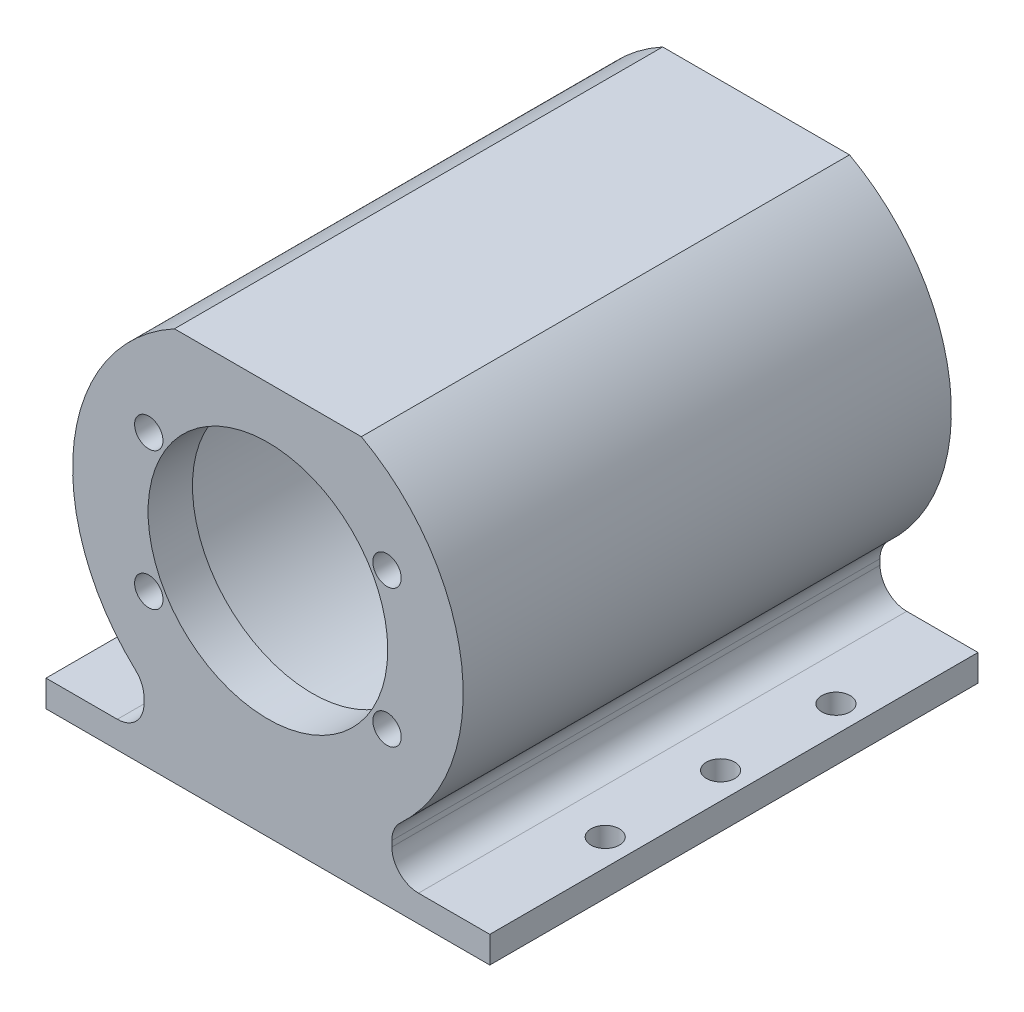
from build123d import *

# Parameters (mm, degrees)
IZIM1_R                     = 18.65
IZIM1_W                     = 50
IZIM1_H                     = 3
Y_KSEKLIK_EKSTR_ZYON4_DEPTH = 55
RADYUS1_R                   = 3
RADYUS2_R                   = 3
IZIM7_R                     = 1.6
KES_EKSTR_ZYON1_DEPTH       = 55
IZIM8_R                     = 1.6
KES_EKSTR_ZYON2_DEPTH       = 55
Y_KSEKLIK_EKSTR_ZYON5_START = -5
IZIM10_R                    = 18.65
IZIM10_R_2                  = 13.5
IZIM10_R_3                  = 1.6
Y_KSEKLIK_EKSTR_ZYON5_DEPTH = 5


with BuildPart() as part:
    # Çizim1 → Yükseklik-Ekstrüzyon4 (new body)
    # profile 1 of 4: a face of its own
    with BuildSketch(Plane.XY):
        with BuildLine():
            ThreePointArc((-10.528747961, 42.81697353), (-21.902220366, 25.57189359), (-13.964240044, 6.5))
            ThreePointArc((-13.964240044, 6.5), (-7.416198487, 2.787684823), (0, 1.5))
            ThreePointArc((0, 1.5), (7.416198487, 2.787684823), (13.964240044, 6.5))
            ThreePointArc((13.964240044, 6.5), (19.889862757, 14.098225725), (22, 23.5))
            ThreePointArc((22, 23.5), (18.916030968, 34.733155052), (10.528747961, 42.81697353))
            Line((10.528747961, 42.81697353), (-10.528747961, 42.81697353))
        make_face()
        with Locations((0, 23.5)):
            Circle(IZIM1_R, mode=Mode.SUBTRACT)
    # profile 2 of 4: a face of its own
    with BuildSketch(Plane.XY):
        Rectangle(IZIM1_W, IZIM1_H)
    # profile 3 of 4: a face of its own
    with BuildSketch(Plane.XY):
        with BuildLine():
            ThreePointArc((0, 1.5), (-7.416198487, 2.787684823), (-13.964240044, 6.5))
            Line((-13.964240044, 6.5), (-13.964240044, 1.5))
            Line((-13.964240044, 1.5), (0, 1.5))
        make_face()
    # profile 4 of 4: a face of its own
    with BuildSketch(Plane.XY):
        with BuildLine():
            ThreePointArc((13.964240044, 6.5), (7.416198487, 2.787684823), (0, 1.5))
            Line((0, 1.5), (13.964240044, 1.5))
            Line((13.964240044, 1.5), (13.964240044, 6.5))
        make_face()
    extrude(amount=Y_KSEKLIK_EKSTR_ZYON4_DEPTH)

    # Radyus1
    radyus1_edges = [part.edges().sort_by_distance(p)[0] for p in [
        (13.964240044, 6.5, 27.5),
        (13.964240044, 1.5, 27.5),
    ]]
    fillet(radyus1_edges, radius=RADYUS1_R)

    # Radyus2
    radyus2_edges = [part.edges().sort_by_distance(p)[0] for p in [
        (-13.964240044, 1.5, 27.5),
        (-13.964240044, 6.5, 27.5),
    ]]
    fillet(radyus2_edges, radius=RADYUS2_R)

    # Çizim7 → Kes-Ekstrüzyon1 (cut)
    with BuildSketch(Plane(origin=(0, 1.5, 0), x_dir=(1, 0, 0), z_dir=(0, 1, 0))):
        with Locations(Location((-22, -13, 0), (0, 0, 270))):
            Circle(IZIM7_R)
        with Locations(Location((-22, -26, 0), (0, 0, 270))):
            Circle(IZIM7_R)
        with Locations(Location((-22, -39, 0), (0, 0, 270))):
            Circle(IZIM7_R)
    extrude(amount=-KES_EKSTR_ZYON1_DEPTH, mode=Mode.SUBTRACT)

    # Çizim8 → Kes-Ekstrüzyon2 (cut)
    with BuildSketch(Plane(origin=(0, 1.5, 0), x_dir=(1, 0, 0), z_dir=(0, 1, 0))):
        with Locations(Location((22, -13, 0), (0, 0, 270))):
            Circle(IZIM8_R)
        with Locations(Location((22, -26, 0), (0, 0, 270))):
            Circle(IZIM8_R)
        with Locations(Location((22, -39, 0), (0, 0, 270))):
            Circle(IZIM8_R)
    extrude(amount=-KES_EKSTR_ZYON2_DEPTH, mode=Mode.SUBTRACT)

    # Çizim10 → Yükseklik-Ekstrüzyon5 (add)
    with BuildSketch(Plane.XY.offset(55).offset(Y_KSEKLIK_EKSTR_ZYON5_START)):
        with Locations((0, 23.5)):
            Circle(IZIM10_R)
        with Locations((0, 23.5)):
            Circle(IZIM10_R_2, mode=Mode.SUBTRACT)
        with Locations((-13.42, 31.25)):
            Circle(IZIM10_R_3, mode=Mode.SUBTRACT)
        with Locations((-13.42, 15.75)):
            Circle(IZIM10_R_3, mode=Mode.SUBTRACT)
        with Locations((13.42, 31.25)):
            Circle(IZIM10_R_3, mode=Mode.SUBTRACT)
        with Locations((13.42, 15.75)):
            Circle(IZIM10_R_3, mode=Mode.SUBTRACT)
    extrude(amount=Y_KSEKLIK_EKSTR_ZYON5_DEPTH)


solid = part.part
